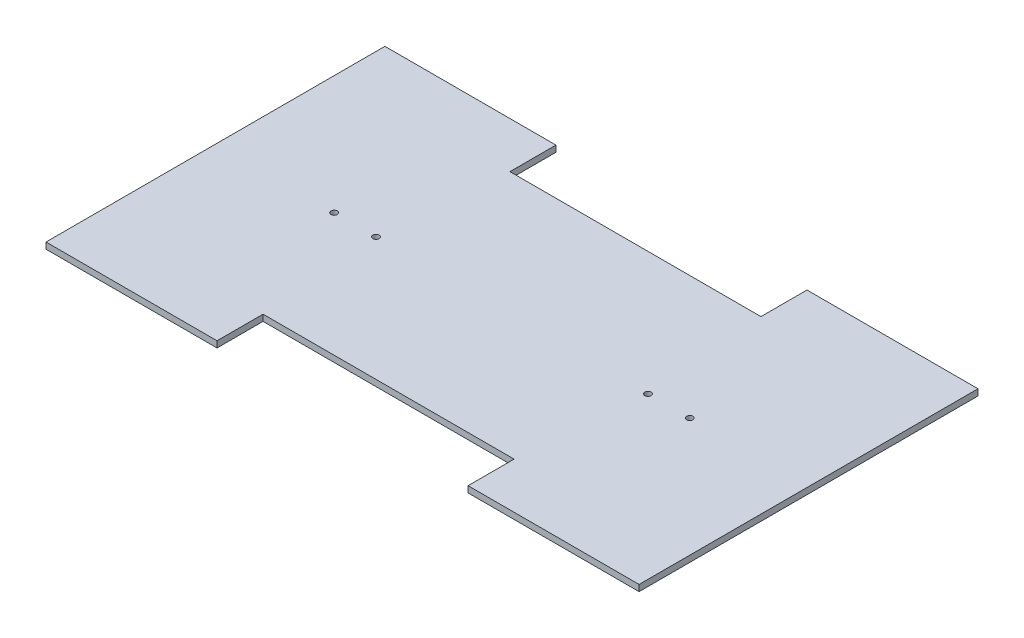
from build123d import *

# Parameters (mm, degrees)
SKETCH1_W               = 283.5
SKETCH1_H               = 162
BOSS_EXTRUDE1_DEPTH     = 3
SKETCH2_W               = 120
SKETCH2_H               = 22
CUT_EXTRUDE1_DEPTH      = 3
CUT_EXTRUDE3_DEPTH      = 164.288280351
CUT_EXTRUDE3_DEPTH_BACK = 164.288280351
SKETCH4_R               = 1.5


with BuildPart() as part:
    # Sketch1 → Boss-Extrude1 (new body)
    with BuildSketch(Plane(origin=(0, 0, 0), x_dir=(1, 0, 0), z_dir=(0, 1, 0))):
        Rectangle(SKETCH1_W, SKETCH1_H)
    extrude(amount=BOSS_EXTRUDE1_DEPTH)

    # Sketch2 → Cut-Extrude1 (cut)
    with BuildSketch(Plane(origin=(0, 3, 0), x_dir=(1, 0, 0), z_dir=(0, 1, 0))):
        with Locations((0, -70)):
            Rectangle(SKETCH2_W, SKETCH2_H)
        with Locations((0, 70)):
            Rectangle(SKETCH2_W, SKETCH2_H)
    extrude(amount=-CUT_EXTRUDE1_DEPTH, mode=Mode.SUBTRACT)

    # Sketch4 → Cut-Extrude3 (cut, two sides: drawn at the far end of the back side and taken through both)
    with BuildSketch(Plane(origin=(0, 3, 0), x_dir=(1, 0, 0), z_dir=(0, 1, 0)).offset(-CUT_EXTRUDE3_DEPTH_BACK)):
        with Locations(Location((-85, 0, 0), (0, 0, 270))):
            Circle(SKETCH4_R)
        with Locations(Location((-65, 0, 0), (0, 0, 270))):
            Circle(SKETCH4_R)
        with Locations(Location((65, 0, 0), (0, 0, 270))):
            Circle(SKETCH4_R)
        with Locations(Location((85, 0, 0), (0, 0, 270))):
            Circle(SKETCH4_R)
    extrude(amount=CUT_EXTRUDE3_DEPTH + CUT_EXTRUDE3_DEPTH_BACK, mode=Mode.SUBTRACT)


solid = part.part
